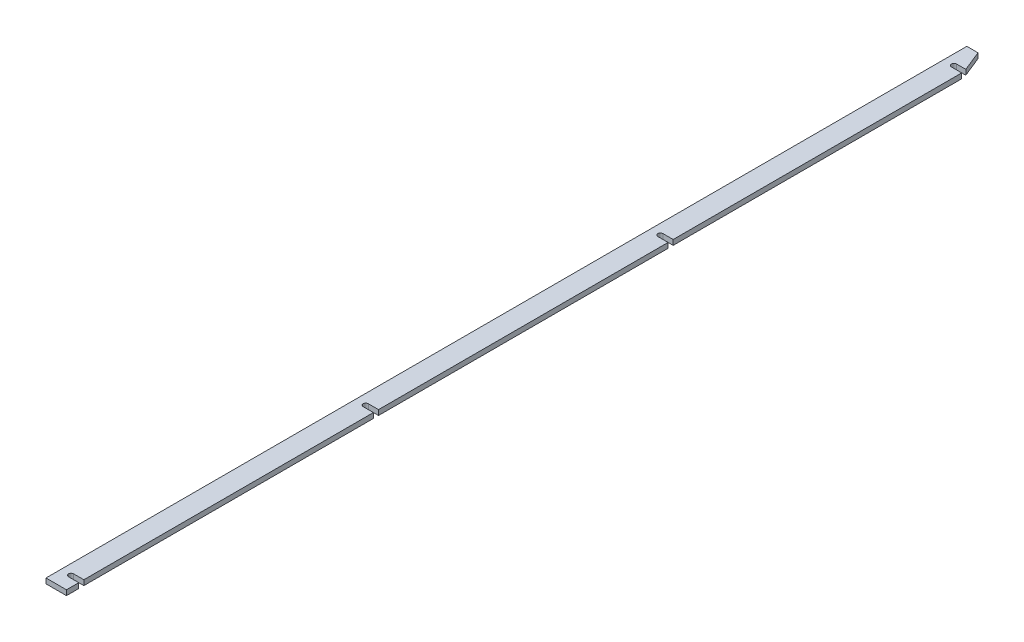
from build123d import *

# Parameters (mm, degrees)
SKETCH1_W           = 6.35
SKETCH1_H           = 285.75
BOSS_EXTRUDE1_DEPTH = 1.5875
CUT_EXTRUDE1_REACH  = 144.919
LPATTERN1_COUNT     = 3
LPATTERN1_PITCH     = 91.44
CUT_EXTRUDE3_DEPTH  = 2.54


with BuildPart() as part:
    # Sketch1 → Boss-Extrude1 (new body)
    with BuildSketch(Plane(origin=(0, 0, 0), x_dir=(1, 0, 0), z_dir=(0, 1, 0))):
        Rectangle(SKETCH1_W, SKETCH1_H)
    extrude(amount=BOSS_EXTRUDE1_DEPTH)

    # Sketch2 → Cut-Extrude1 (cut, up to next)
    with BuildSketch(Plane(origin=(0, 1.5875, 0), x_dir=(1, 0, 0), z_dir=(0, 1, 0)), mode=Mode.PRIVATE) as cut_extrude1_sk1:
        with BuildLine():
            Line((3.175, -139.065), (0, -139.065))
            ThreePointArc((0, -139.065), (-0.79375, -138.27125), (0, -137.4775))
            Line((0, -137.4775), (3.175, -137.4775))
            Line((3.175, -137.4775), (3.175, -139.065))
        make_face()
    cut_extrude1_tool1 = extrude(cut_extrude1_sk1.sketch, amount=-CUT_EXTRUDE1_REACH, mode=Mode.PRIVATE) & part.part
    cut_extrude1 = cut_extrude1_tool1.solids().sort_by_distance((1.271664, 1.5875, 138.27125))[0]
    add(cut_extrude1, mode=Mode.SUBTRACT)

    # LPattern1: Cut-Extrude1 ×3
    with Locations(*[(0, 0, -i * LPATTERN1_PITCH) for i in range(1, LPATTERN1_COUNT)]):
        add(cut_extrude1, mode=Mode.SUBTRACT)

    # Sketch4 → Cut-Extrude3 (cut)
    with BuildSketch(Plane(origin=(0, 1.5875, 0), x_dir=(-1, 0, 0), z_dir=(0, 1, 0))):
        with BuildLine():
            Line((-2.85454303, -136.525), (0, -136.525))
            ThreePointArc((0, -136.525), (0.79375, -135.73125), (0, -134.9375))
            Line((0, -134.9375), (-3.175, -134.9375))
            Line((-3.175, -134.9375), (-3.175, -142.875))
            Line((-3.175, -142.875), (-0.290887271, -142.875))
            Line((-0.290887271, -142.875), (-2.85454303, -136.525))
        make_face()
    extrude(amount=-CUT_EXTRUDE3_DEPTH, mode=Mode.SUBTRACT)


solid = part.part
